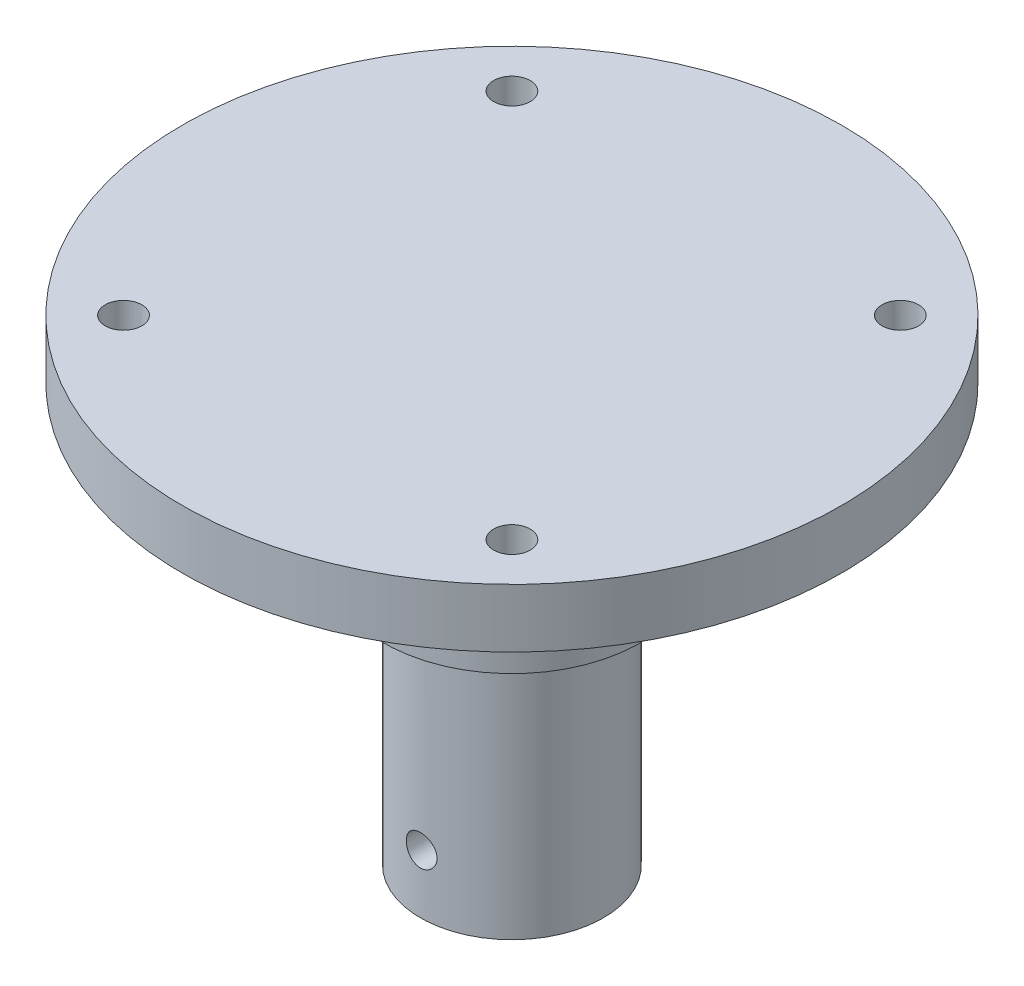
from build123d import *

# Parameters (mm, degrees)
BROCA_DE_ROSQUEAR_PARA_TARRAXA_DE_M62_D = 5
ESBO_O4_R                               = 3.1
CORTE_EXTRUS_O1_DEPTH                   = 18
ESBO_O7_W                               = 2.1
ESBO_O7_H                               = 45
ESBO_O8_R                               = 17.5
ESBO_O8_R_2                             = 12.5
CORTE_EXTRUS_O2_DEPTH                   = 35


with BuildPart() as part:
    # Esboço1 → Revolução1 (revolve)
    with BuildSketch(Plane.XY, mode=Mode.PRIVATE) as revolu_o1_sk:
        Polygon((0, 0), (0, 65), (45, 65), (45, 57), (17.5, 57), (17.5, 0), align=None)
    revolve(revolu_o1_sk.sketch.rotate(Axis((0, 0, 0), (0, 1, 0)), 90), axis=Axis((0, 0, 0), (0, 1, 0)))

    # Broca de rosquear para tarraxa de M62 (through all)
    with Locations(Plane(origin=(0, 65, 0), x_dir=(1, 0, 0), z_dir=(0, 1, 0))):
        with Locations((26.516504294, 26.516504294), (-26.516504294, -26.516504294), (-26.516504294, 26.516504294), (26.516504294, -26.516504294)):
            Hole(BROCA_DE_ROSQUEAR_PARA_TARRAXA_DE_M62_D / 2)

    # Esboço4 → Corte-extrusão1 (cut)
    with BuildSketch(Plane.XZ):
        with Locations(Location((0, 0, 0), (0, 0, 270))):
            Circle(ESBO_O4_R)
    extrude(amount=-CORTE_EXTRUS_O1_DEPTH, mode=Mode.SUBTRACT)

    # Esboço7 → Broca de rosquear para tarraxa de M52 (revolve, cut)
    with BuildSketch(Plane(origin=(0, 8, 0), x_dir=(0, 1, 0), z_dir=(1, 0, 0))):
        with Locations((1.05, 22.5)):
            Rectangle(ESBO_O7_W, ESBO_O7_H)
    revolve(axis=Axis((0, 8, -6.35), (0, 0, 1)), mode=Mode.SUBTRACT)

    # Esboço8 → Corte-extrusão2 (cut)
    with BuildSketch(Plane.XZ):
        with Locations(Location((0, 0, 0), (0, 0, 270))):
            Circle(ESBO_O8_R)
        with Locations(Location((0, 0, 0), (0, 0, 270))):
            Circle(ESBO_O8_R_2, mode=Mode.SUBTRACT)
    extrude(amount=-CORTE_EXTRUS_O2_DEPTH, mode=Mode.SUBTRACT)


solid = part.part
